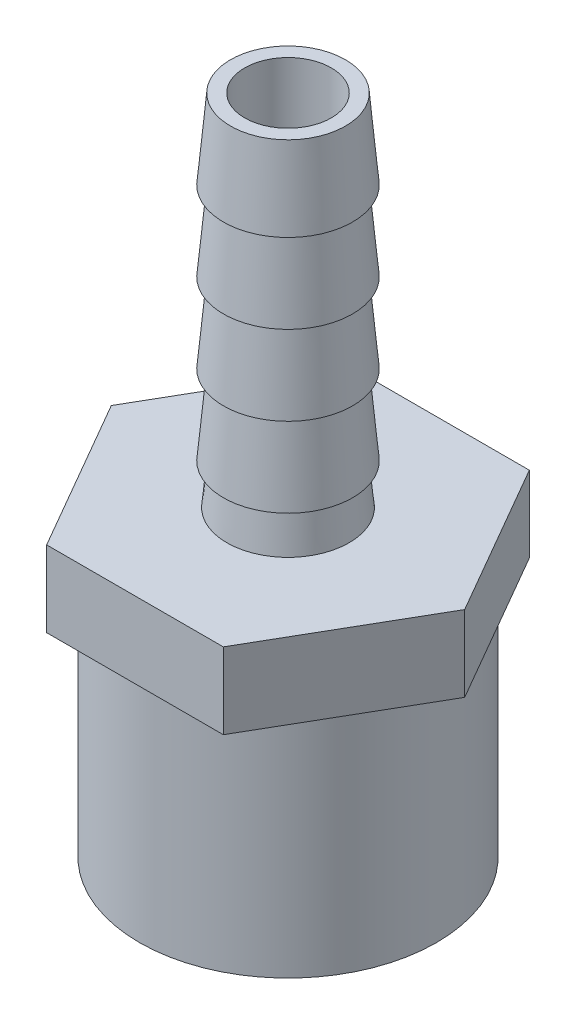
from build123d import *

# Parameters (mm, degrees)
SKETCH1_R           = 2.45
BOSS_EXTRUDE1_DEPTH = 4.3
LOWER_THREADS_R     = 8.4
LOWER_THREADS_R_2   = 5.55
BOSS_EXTRUDE2_DEPTH = 12.8


with BuildPart() as part:
    # Sketch1 → Boss-Extrude1 (new body)
    with BuildSketch(Plane(origin=(0, 0, 0), x_dir=(1, 0, 0), z_dir=(0, 1, 0))):
        Polygon((9.988159657, 0), (4.994079828, 8.65), (-4.994079828, 8.65), (-9.988159657, 0), (-4.994079828, -8.65), (4.994079828, -8.65), align=None)
        with Locations(Location((0, 0, 0), (0, 0, 270))):
            Circle(SKETCH1_R, mode=Mode.SUBTRACT)
    extrude(amount=-BOSS_EXTRUDE1_DEPTH)

    # Sketch2 → Revolve1 (revolve)
    with BuildSketch(Plane.XY, mode=Mode.PRIVATE) as revolve1_sk:
        Polygon((2.45, 0), (2.45, 20.3), (3.25, 20.3), (3.65, 15.8), (3.25, 15.8), (3.65, 11.3), (3.25, 11.3), (3.65, 6.8), (3.25, 6.8), (3.65, 2.3), (3.25, 2.3), (3.454444444, 0), align=None)
    revolve(revolve1_sk.sketch.rotate(Axis((0, -1.995266411, 0), (0, 1, 0)), 90), axis=Axis((0, -1.995266411, 0), (0, 1, 0)))

    # Lower Threads → Boss-Extrude2 (add)
    with BuildSketch(Plane.XZ.offset(4.3)):
        with Locations(Location((0, 0, 0), (0, 0, 270))):
            Circle(LOWER_THREADS_R)
        with Locations(Location((0, 0, 0), (0, 0, 270))):
            Circle(LOWER_THREADS_R_2, mode=Mode.SUBTRACT)
    extrude(amount=BOSS_EXTRUDE2_DEPTH)


solid = part.part
